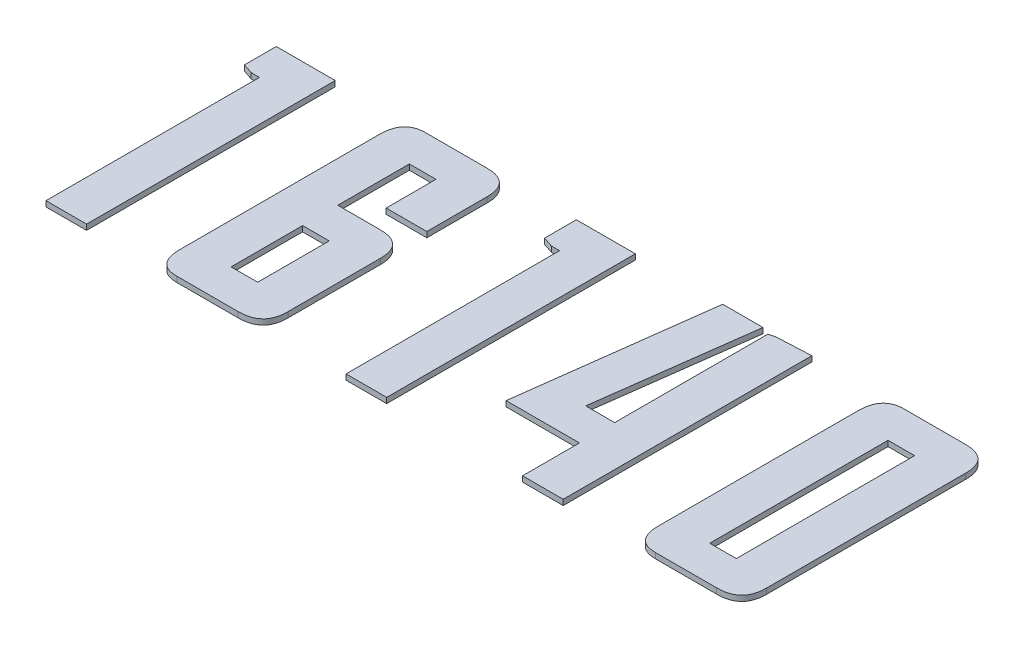
from build123d import *

# Parameters (mm, degrees)
BOSS_EXTRUDE1_DEPTH   = 1.2
SKETCH1_W             = 5.822409575
SKETCH1_H             = 15.664234043
BOSS_EXTRUDE1_2_DEPTH = 1.2
BOSS_EXTRUDE1_3_DEPTH = 1.2
BOSS_EXTRUDE1_4_DEPTH = 1.2
SKETCH1_W_2           = 5.822409574
SKETCH1_H_2           = 39.034260638
BOSS_EXTRUDE1_5_DEPTH = 1.2


with BuildPart() as part:
    # Sketch1 → Boss-Extrude1 (new body)
    with BuildSketch(Plane(origin=(0, 0, 0), x_dir=(1, 0, 0), z_dir=(0, 1, 0))):
        Polygon((1.332148936, 47.475031915), (1.332148936, 54.445845745), (14.240212766, 54.445845745), (14.240212766, 0), (5.35156383, 0), (5.35156383, 46.740053191), (3.537085106, 46.740053191), align=None)
    extrude(amount=BOSS_EXTRUDE1_DEPTH)


with BuildPart() as body_2:
    # Sketch1 → Boss-Extrude1 2 (new body)
    with BuildSketch(Plane(origin=(0, 0, 0), x_dir=(1, 0, 0), z_dir=(0, 1, 0))):
        with BuildLine():
            Line((43.993070213, 35.841696809), (43.993070213, 46.740053191))
            Line((43.993070213, 46.740053191), (38.170660638, 46.740053191))
            Line((38.170660638, 46.740053191), (38.170660638, 31.075819149))
            Line((38.170660638, 31.075819149), (47.403830851, 31.075819149))
            add(Edge.make_bspline(
                [(47.403830851, 31.075819149), (47.833934363, 31.063337821), (48.645254992, 31.039793818), (49.780594728, 30.788496049), (50.75064648, 30.360326032), (51.551765813, 29.755321844), (52.170203012, 28.967190952), (52.59070034, 28.007509348), (52.860775148, 26.891166669), (52.882004168, 26.089657952), (52.893203191, 25.666835106)],
                knots=[0, 0, 0, 0, 1.167027584, 2.201408559, 3.136967793, 4.027212192, 4.901025933, 5.82711576, 6.853730371, 8, 8, 8, 8], degree=3))
            Line((52.893203191, 25.666835106), (52.893203191, 5.408984043))
            add(Edge.make_bspline(
                [(52.893203191, 5.408984043), (52.882004168, 4.986161196), (52.860775148, 4.18465248), (52.59070034, 3.068309801), (52.170203012, 2.108628197), (51.551765813, 1.320497305), (50.75064648, 0.715493117), (49.780594728, 0.2873231), (48.645254992, 0.036025331), (47.833934363, 0.012481328), (47.403830851, 0)],
                knots=[0, 0, 0, 0, 1.146269629, 2.17288424, 3.098974067, 3.972787808, 4.863032207, 5.798591441, 6.832972416, 8, 8, 8, 8], degree=3))
            Line((47.403830851, 0), (34.024921277, 0))
            add(Edge.make_bspline(
                [(34.024921277, 0), (33.651965003, 0.012472554), (32.946008959, 0.03608142), (31.958296205, 0.290880296), (31.115187051, 0.720045297), (30.43207145, 1.336917405), (29.901306339, 2.120659222), (29.542869308, 3.076320201), (29.308504938, 4.188060803), (29.29117846, 4.986540056), (29.282011702, 5.408984043)],
                knots=[0, 0, 0, 0, 1.084734094, 2.05325569, 2.94625814, 3.815111374, 4.706091482, 5.677498929, 6.771255973, 8, 8, 8, 8], degree=3))
            Line((29.282011702, 5.408984043), (29.282011702, 49.036861702))
            add(Edge.make_bspline(
                [(29.282011702, 49.036861702), (29.29117846, 49.459305689), (29.308504938, 50.257784941), (29.542869308, 51.369525544), (29.901306339, 52.325186523), (30.43207145, 53.108928339), (31.115187051, 53.725800448), (31.958296205, 54.154965449), (32.946008959, 54.409764325), (33.651965003, 54.433373191), (34.024921277, 54.445845745)],
                knots=[0, 0, 0, 0, 1.228744027, 2.322501071, 3.293908518, 4.184888626, 5.05374186, 5.94674431, 6.915265906, 8, 8, 8, 8], degree=3))
            Line((34.024921277, 54.445845745), (47.403830851, 54.445845745))
            add(Edge.make_bspline(
                [(47.403830851, 54.445845745), (47.833934363, 54.433364417), (48.645254992, 54.409820413), (49.780594728, 54.158522645), (50.75064648, 53.730352627), (51.551765813, 53.12534844), (52.170203012, 52.337217547), (52.59070034, 51.377535943), (52.860775148, 50.261193265), (52.882004168, 49.459684548), (52.893203191, 49.036861702)],
                knots=[0, 0, 0, 0, 1.167027584, 2.201408559, 3.136967793, 4.027212192, 4.901025933, 5.82711576, 6.853730371, 8, 8, 8, 8], degree=3))
            Line((52.893203191, 49.036861702), (52.893203191, 35.841696809))
            Line((52.893203191, 35.841696809), (43.993070213, 35.841696809))
        make_face()
        with Locations((41.081865425, 15.537909575)):
            Rectangle(SKETCH1_W, SKETCH1_H, mode=Mode.SUBTRACT)
    extrude(amount=BOSS_EXTRUDE1_2_DEPTH)


with BuildPart() as body_3:
    # Sketch1 → Boss-Extrude1 3 (new body)
    with BuildSketch(Plane(origin=(0, 0, 0), x_dir=(1, 0, 0), z_dir=(0, 1, 0))):
        Polygon((67.039246809, 47.475031915), (67.039246809, 54.445845745), (79.947310638, 54.445845745), (79.947310638, 0), (71.058661702, 0), (71.058661702, 46.740053191), (69.244182979, 46.740053191), align=None)
    extrude(amount=BOSS_EXTRUDE1_3_DEPTH)


with BuildPart() as body_4:
    # Sketch1 → Boss-Extrude1 4 (new body)
    with BuildSketch(Plane(origin=(0, 0, 0), x_dir=(1, 0, 0), z_dir=(0, 1, 0))):
        Polygon((111.170125532, 54.078356383), (118.600301064, 54.445845745), (118.600301064, 0), (109.700168085, 0), (109.700168085, 12.46018617), (93.645476596, 12.46018617), (99.077428723, 54.445845745), (107.897173404, 54.445845745), (103.349492553, 20.165978723), (109.700168085, 20.165978723), (109.700168085, 53.710867021), align=None)
    extrude(amount=BOSS_EXTRUDE1_4_DEPTH)


with BuildPart() as body_5:
    # Sketch1 → Boss-Extrude1 5 (new body)
    with BuildSketch(Plane(origin=(0, 0, 0), x_dir=(1, 0, 0), z_dir=(0, 1, 0))):
        with BuildLine():
            add(Edge.make_bspline(
                [(152.211796809, 54.445845745), (152.641900321, 54.433364417), (153.45322095, 54.409820413), (154.588560686, 54.158522645), (155.558612438, 53.730352627), (156.35973177, 53.12534844), (156.97816897, 52.337217547), (157.398666297, 51.377535943), (157.668741105, 50.261193265), (157.689970126, 49.459684548), (157.701169149, 49.036861702)],
                knots=[0, 0, 0, 0, 1.167027584, 2.201408559, 3.136967793, 4.027212192, 4.901025933, 5.82711576, 6.853730371, 8, 8, 8, 8], degree=3))
            Line((157.701169149, 49.036861702), (157.701169149, 5.408984043))
            add(Edge.make_bspline(
                [(157.701169149, 5.408984043), (157.689970126, 4.986161196), (157.668741105, 4.18465248), (157.398666297, 3.068309801), (156.97816897, 2.108628197), (156.35973177, 1.320497305), (155.558612438, 0.715493117), (154.588560686, 0.2873231), (153.45322095, 0.036025331), (152.641900321, 0.012481328), (152.211796809, 0)],
                knots=[0, 0, 0, 0, 1.146269629, 2.17288424, 3.098974067, 3.972787808, 4.863032207, 5.798591441, 6.832972416, 8, 8, 8, 8], degree=3))
            Line((152.211796809, 0), (138.832887234, 0))
            add(Edge.make_bspline(
                [(138.832887234, 0), (138.459930961, 0.012472554), (137.753974916, 0.03608142), (136.766262162, 0.290880296), (135.923153009, 0.720045297), (135.240037407, 1.336917405), (134.709272296, 2.120659222), (134.350835266, 3.076320201), (134.116470895, 4.188060803), (134.099144418, 4.986540056), (134.08997766, 5.408984043)],
                knots=[0, 0, 0, 0, 1.084734094, 2.05325569, 2.94625814, 3.815111374, 4.706091482, 5.677498929, 6.771255973, 8, 8, 8, 8], degree=3))
            Line((134.08997766, 5.408984043), (134.08997766, 49.036861702))
            add(Edge.make_bspline(
                [(134.08997766, 49.036861702), (134.099144418, 49.459305689), (134.116470895, 50.257784941), (134.350835266, 51.369525544), (134.709272296, 52.325186523), (135.240037407, 53.108928339), (135.923153009, 53.725800448), (136.766262162, 54.154965449), (137.753974916, 54.409764325), (138.459930961, 54.433373191), (138.832887234, 54.445845745)],
                knots=[0, 0, 0, 0, 1.228744027, 2.322501071, 3.293908518, 4.184888626, 5.05374186, 5.94674431, 6.915265906, 8, 8, 8, 8], degree=3))
            Line((138.832887234, 54.445845745), (152.211796809, 54.445845745))
        make_face()
        with Locations((145.889831383, 27.222922872)):
            Rectangle(SKETCH1_W_2, SKETCH1_H_2, mode=Mode.SUBTRACT)
    extrude(amount=BOSS_EXTRUDE1_5_DEPTH)


solid = Compound([part.part, body_2.part, body_3.part, body_4.part, body_5.part])
